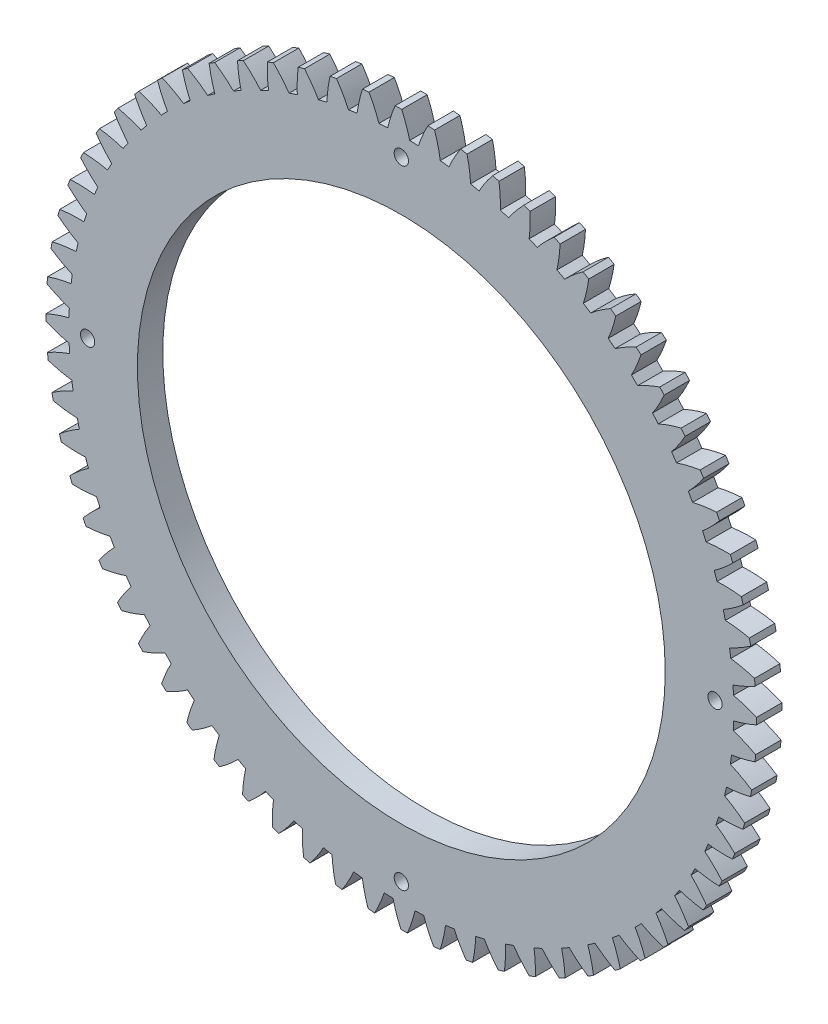
from build123d import *

# Parameters (mm, degrees)
BOSS_EXTRUDE1_DEPTH = 6.35
SKETCH3_R           = 66.04
CUT_EXTRUDE1_DEPTH  = 6.35
SKETCH4_R           = 1.7859375
CUT_EXTRUDE2_DEPTH  = 6.35
CIRPATTERN1_COUNT   = 4


with BuildPart() as part:
    # Sketch1 → Boss-Extrude1 (new body)
    with BuildSketch(Plane.XY):
        with BuildLine():
            ThreePointArc((-88.886888556, -1.526775321), (-86.041824866, -2.597533758), (-83.113641429, -3.41402184))
            ThreePointArc((-83.113641429, -3.41402184), (-83.061763444, -4.502931296), (-82.995619777, -5.591067383))
            ThreePointArc((-82.995619777, -5.591067383), (-85.818374995, -6.719324449), (-88.531009456, -8.091375947))
            ThreePointArc((-88.531009456, -8.091375947), (-88.45268089, -8.906921099), (-88.366839705, -9.721709751))
            ThreePointArc((-88.366839705, -9.721709751), (-85.435115431, -10.525391163), (-82.444087093, -11.068217569))
            ThreePointArc((-82.444087093, -11.068217569), (-82.291958521, -12.147695232), (-82.12569648, -13.225086554))
            ThreePointArc((-82.12569648, -13.225086554), (-84.832307893, -14.608981668), (-87.406773793, -16.225470568))
            ThreePointArc((-87.406773793, -16.225470568), (-87.253530349, -17.030309499), (-87.092876136, -17.833701982))
            ThreePointArc((-87.092876136, -17.833701982), (-84.099503716, -18.363449641), (-81.071148875, -18.627983167))
            ThreePointArc((-81.071148875, -18.627983167), (-80.820067624, -19.688819316), (-80.555105697, -20.746273951))
            ThreePointArc((-80.555105697, -20.746273951), (-83.122481452, -22.374000207), (-85.536814354, -24.221135195))
            ThreePointArc((-85.536814354, -24.221135195), (-85.309963452, -25.008401304), (-85.075866855, -25.793543355))
            ThreePointArc((-85.075866855, -25.793543355), (-82.046384686, -26.044837642), (-79.006540199, -26.028821382))
            ThreePointArc((-79.006540199, -26.028821382), (-78.658648405, -27.061965335), (-78.297247155, -28.090461453))
            ThreePointArc((-78.297247155, -28.090461453), (-80.703483306, -29.948131665), (-82.937084975, -32.010153637))
            ThreePointArc((-82.937084975, -32.010153637), (-82.638562027, -32.773130246), (-82.333020276, -33.533323311))
            ThreePointArc((-82.333020276, -33.533323311), (-79.293274832, -33.504020271), (-76.267875579, -33.207590869))
            ThreePointArc((-76.267875579, -33.207590869), (-75.826141333, -34.204228207), (-75.371384108, -35.194991042))
            ThreePointArc((-75.371384108, -35.194991042), (-77.595951496, -37.266756222), (-79.62976563, -39.526072734))
            ThreePointArc((-79.62976563, -39.526072734), (-79.262117528, -40.258250397), (-78.887737397, -40.987008776))
            ThreePointArc((-78.887737397, -40.987008776), (-75.863662715, -40.677358412), (-72.878520336, -40.1030449))
            ThreePointArc((-72.878520336, -40.1030449), (-72.346712358, -41.054672665), (-71.802478986, -41.999249377))
            ThreePointArc((-71.802478986, -41.999249377), (-73.826398388, -44.267433956), (-75.643073201, -46.704769315))
            ThreePointArc((-75.643073201, -46.704769315), (-75.209436589, -47.39990135), (-74.769412157, -48.091007534))
            ThreePointArc((-74.769412157, -48.091007534), (-71.786808576, -47.503651674), (-68.867391254, -46.656353892))
            ThreePointArc((-68.867391254, -46.656353892), (-68.250046743, -47.554853131), (-67.62098043, -48.445184925))
            ThreePointArc((-67.62098043, -48.445184925), (-69.426984479, -50.890437551), (-71.011020742, -53.484997272))
            ThreePointArc((-71.011020742, -53.484997272), (-70.515095255, -54.137153058), (-70.013180656, -54.784710772))
            ThreePointArc((-70.013180656, -54.784710772), (-67.097494698, -53.924660529), (-64.268709872, -52.811607324))
            ThreePointArc((-64.268709872, -52.811607324), (-63.571095793, -53.649312358), (-62.862563512, -54.477803236))
            ThreePointArc((-62.862563512, -54.477803236), (-64.435244017, -57.079261876), (-65.773127292, -59.80891009))
            ThreePointArc((-65.773127292, -59.80891009), (-65.219143992, -60.412525663), (-64.659621384, -61.011010174))
            ThreePointArc((-64.659621384, -61.011010174), (-61.835728653, -59.885603194), (-59.121710518, -58.516290742))
            ThreePointArc((-59.121710518, -58.516290742), (-58.349778668, -59.286054567), (-57.567825367, -60.045636138))
            ThreePointArc((-57.567825367, -60.045636138), (-58.893764773, -62.781106065), (-59.974080712, -65.622554376))
            ThreePointArc((-59.974080712, -65.622554376), (-59.366765987, -66.172479901), (-58.754409021, -66.716785149))
            ThreePointArc((-58.754409021, -66.716785149), (-56.046401973, -65.335623007), (-53.470305575, -63.7217338))
            ThreePointArc((-53.470305575, -63.7217338), (-52.630641805, -64.416989063), (-51.781938833, -65.101180845))
            ThreePointArc((-51.781938833, -65.101180845), (-52.849824694, -67.947323993), (-53.66335642, -70.876330165))
            ThreePointArc((-53.66335642, -70.876330165), (-53.007891667, -71.367873872), (-52.347924755, -71.853356037))
            ThreePointArc((-52.347924755, -71.853356037), (-49.778907154, -70.228222322), (-47.362710838, -68.383525493))
            ThreePointArc((-47.362710838, -68.383525493), (-46.462478863, -68.998340521), (-45.554267055, -69.60130523))
            ThreePointArc((-45.554267055, -69.60130523), (-46.354988544, -72.53383931), (-46.894795293, -75.525414096))
            ThreePointArc((-46.894795293, -75.525414096), (-46.196772706, -75.954382306), (-45.494826454, -76.376899426))
            ThreePointArc((-45.494826454, -76.376899426), (-43.08671625, -74.521659205), (-40.851034152, -72.461893057))
            ThreePointArc((-40.851034152, -72.461893057), (-39.897914433, -72.991022466), (-38.937942333, -73.50761582))
            ThreePointArc((-38.937942333, -73.50761582), (-39.464667976, -76.501521485), (-39.726144307, -79.530141824))
            ThreePointArc((-39.726144307, -79.530141824), (-38.991519168, -79.892874732), (-38.253582334, -80.248822039))
            ThreePointArc((-38.253582334, -80.248822039), (-36.026924675, -78.179303568), (-33.990830846, -75.9220413))
            ThreePointArc((-33.990830846, -75.9220413), (-32.992955066, -76.360970742), (-31.989412816, -76.78678535))
            ThreePointArc((-31.989412816, -76.78678535), (-32.237648776, -79.816519652), (-32.218563865, -82.856346422))
            ThreePointArc((-32.218563865, -82.856346422), (-31.453603737, -83.14974932), (-30.685972137, -83.436089997))
            ThreePointArc((-30.685972137, -83.436089997), (-28.659764082, -81.169949678), (-26.840629756, -78.734449455))
            ThreePointArc((-26.840629756, -78.734449455), (-25.806511439, -79.079434141), (-24.767960907, -79.410837102))
            ThreePointArc((-24.767960907, -79.410837102), (-24.735589324, -82.450551416), (-24.436105996, -85.475649888))
            ThreePointArc((-24.436105996, -85.475649888), (-23.647337249, -85.697219564), (-22.856560045, -85.911510654))
            ThreePointArc((-22.856560045, -85.911510654), (-21.048088486, -83.468082397), (-19.461433877, -80.875123049))
            ThreePointArc((-19.461433877, -80.875123049), (-18.399895755, -81.12321969), (-17.33519749, -81.357383591))
            ThreePointArc((-17.33519749, -81.357383591), (-17.022494544, -84.381144146), (-16.445167887, -87.365705246))
            ThreePointArc((-16.445167887, -87.365705246), (-15.639320018, -87.513551347), (-14.832143843, -87.653964594))
            ThreePointArc((-14.832143843, -87.653964594), (-13.256838021, -85.054094867), (-11.916199906, -82.325798608))
            ThreePointArc((-11.916199906, -82.325798608), (-10.836298648, -82.474890532), (-9.754536279, -82.609817568))
            ThreePointArc((-9.754536279, -82.609817568), (-9.164169844, -85.591826707), (-8.313925404, -88.510387212))
            ThreePointArc((-8.313925404, -88.510387212), (-7.497873622, -88.583248366), (-6.681185018, -88.648585814))
            ThreePointArc((-6.681185018, -88.648585814), (-5.352484888, -85.914455789), (-4.269301119, -83.074099482))
            ThreePointArc((-4.269301119, -83.074099482), (-3.180250062, -83.122914688), (-2.090652805, -83.15745371))
            ThreePointArc((-2.090652805, -83.15745371), (-1.227659677, -86.072269981), (-0.11175144, -88.899929762))
            ThreePointArc((-0.11175144, -88.899929762), (0.707541988, -88.897184344), (1.526775321, -88.886888556))
            ThreePointArc((1.526775321, -88.886888556), (2.597533758, -86.041824866), (3.41402184, -83.113641429))
            ThreePointArc((3.41402184, -83.113641429), (4.502931296, -83.061763444), (5.591067383, -82.995619777))
            ThreePointArc((5.591067383, -82.995619777), (6.719324449, -85.818374995), (8.091375947, -88.531009456))
            ThreePointArc((8.091375947, -88.531009456), (8.906921099, -88.45268089), (9.721709751, -88.366839705))
            ThreePointArc((9.721709751, -88.366839705), (10.525391163, -85.435115431), (11.068217569, -82.444087093))
            ThreePointArc((11.068217569, -82.444087093), (12.147695232, -82.291958521), (13.225086554, -82.12569648))
            ThreePointArc((13.225086554, -82.12569648), (14.608981668, -84.832307893), (16.225470568, -87.406773793))
            ThreePointArc((16.225470568, -87.406773793), (17.030309499, -87.253530349), (17.833701982, -87.092876136))
            ThreePointArc((17.833701982, -87.092876136), (18.363449641, -84.099503716), (18.627983167, -81.071148875))
            ThreePointArc((18.627983167, -81.071148875), (19.688819316, -80.820067624), (20.746273951, -80.555105697))
            ThreePointArc((20.746273951, -80.555105697), (22.374000207, -83.122481452), (24.221135195, -85.536814354))
            ThreePointArc((24.221135195, -85.536814354), (25.008401304, -85.309963452), (25.793543355, -85.075866855))
            ThreePointArc((25.793543355, -85.075866855), (26.044837642, -82.046384686), (26.028821382, -79.006540199))
            ThreePointArc((26.028821382, -79.006540199), (27.061965335, -78.658648405), (28.090461453, -78.297247155))
            ThreePointArc((28.090461453, -78.297247155), (29.948131665, -80.703483306), (32.010153637, -82.937084975))
            ThreePointArc((32.010153637, -82.937084975), (32.773130246, -82.638562027), (33.533323311, -82.333020276))
            ThreePointArc((33.533323311, -82.333020276), (33.504020271, -79.293274832), (33.207590869, -76.267875579))
            ThreePointArc((33.207590869, -76.267875579), (34.204228207, -75.826141333), (35.194991042, -75.371384108))
            ThreePointArc((35.194991042, -75.371384108), (37.266756222, -77.595951496), (39.526072734, -79.62976563))
            ThreePointArc((39.526072734, -79.62976563), (40.258250397, -79.262117528), (40.987008776, -78.887737397))
            ThreePointArc((40.987008776, -78.887737397), (40.677358412, -75.863662715), (40.1030449, -72.878520336))
            ThreePointArc((40.1030449, -72.878520336), (41.054672665, -72.346712358), (41.999249377, -71.802478986))
            ThreePointArc((41.999249377, -71.802478986), (44.267433956, -73.826398388), (46.704769315, -75.643073201))
            ThreePointArc((46.704769315, -75.643073201), (47.39990135, -75.209436589), (48.091007534, -74.769412157))
            ThreePointArc((48.091007534, -74.769412157), (47.503651674, -71.786808576), (46.656353892, -68.867391254))
            ThreePointArc((46.656353892, -68.867391254), (47.554853131, -68.250046743), (48.445184925, -67.62098043))
            ThreePointArc((48.445184925, -67.62098043), (50.890437551, -69.426984479), (53.484997272, -71.011020742))
            ThreePointArc((53.484997272, -71.011020742), (54.137153058, -70.515095255), (54.784710772, -70.013180656))
            ThreePointArc((54.784710772, -70.013180656), (53.924660529, -67.097494698), (52.811607324, -64.268709872))
            ThreePointArc((52.811607324, -64.268709872), (53.649312358, -63.571095793), (54.477803236, -62.862563512))
            ThreePointArc((54.477803236, -62.862563512), (57.079261876, -64.435244017), (59.80891009, -65.773127292))
            ThreePointArc((59.80891009, -65.773127292), (60.412525663, -65.219143992), (61.011010174, -64.659621384))
            ThreePointArc((61.011010174, -64.659621384), (59.885603194, -61.835728653), (58.516290742, -59.121710518))
            ThreePointArc((58.516290742, -59.121710518), (59.286054567, -58.349778668), (60.045636138, -57.567825367))
            ThreePointArc((60.045636138, -57.567825367), (62.781106065, -58.893764773), (65.622554376, -59.974080712))
            ThreePointArc((65.622554376, -59.974080712), (66.172479901, -59.366765987), (66.716785149, -58.754409021))
            ThreePointArc((66.716785149, -58.754409021), (65.335623007, -56.046401973), (63.7217338, -53.470305575))
            ThreePointArc((63.7217338, -53.470305575), (64.416989063, -52.630641805), (65.101180845, -51.781938833))
            ThreePointArc((65.101180845, -51.781938833), (67.947323993, -52.849824694), (70.876330165, -53.66335642))
            ThreePointArc((70.876330165, -53.66335642), (71.367873872, -53.007891667), (71.853356037, -52.347924755))
            ThreePointArc((71.853356037, -52.347924755), (70.228222322, -49.778907154), (68.383525493, -47.362710838))
            ThreePointArc((68.383525493, -47.362710838), (68.998340521, -46.462478863), (69.60130523, -45.554267055))
            ThreePointArc((69.60130523, -45.554267055), (72.53383931, -46.354988544), (75.525414096, -46.894795293))
            ThreePointArc((75.525414096, -46.894795293), (75.954382306, -46.196772706), (76.376899426, -45.494826454))
            ThreePointArc((76.376899426, -45.494826454), (74.521659205, -43.08671625), (72.461893057, -40.851034152))
            ThreePointArc((72.461893057, -40.851034152), (72.991022466, -39.897914433), (73.50761582, -38.937942333))
            ThreePointArc((73.50761582, -38.937942333), (76.501521485, -39.464667976), (79.530141824, -39.726144307))
            ThreePointArc((79.530141824, -39.726144307), (79.892874732, -38.991519168), (80.248822039, -38.253582334))
            ThreePointArc((80.248822039, -38.253582334), (78.179303568, -36.026924675), (75.9220413, -33.990830846))
            ThreePointArc((75.9220413, -33.990830846), (76.360970742, -32.992955066), (76.78678535, -31.989412816))
            ThreePointArc((76.78678535, -31.989412816), (79.816519652, -32.237648776), (82.856346422, -32.218563865))
            ThreePointArc((82.856346422, -32.218563865), (83.14974932, -31.453603737), (83.436089997, -30.685972137))
            ThreePointArc((83.436089997, -30.685972137), (81.169949678, -28.659764082), (78.734449455, -26.840629756))
            ThreePointArc((78.734449455, -26.840629756), (79.079434141, -25.806511439), (79.410837102, -24.767960907))
            ThreePointArc((79.410837102, -24.767960907), (82.450551416, -24.735589324), (85.475649888, -24.436105996))
            ThreePointArc((85.475649888, -24.436105996), (85.697219564, -23.647337249), (85.911510654, -22.856560045))
            ThreePointArc((85.911510654, -22.856560045), (83.468082397, -21.048088486), (80.875123049, -19.461433877))
            ThreePointArc((80.875123049, -19.461433877), (81.12321969, -18.399895755), (81.357383591, -17.33519749))
            ThreePointArc((81.357383591, -17.33519749), (84.381144146, -17.022494544), (87.365705246, -16.445167887))
            ThreePointArc((87.365705246, -16.445167887), (87.513551347, -15.639320018), (87.653964594, -14.832143843))
            ThreePointArc((87.653964594, -14.832143843), (85.054094867, -13.256838021), (82.325798608, -11.916199906))
            ThreePointArc((82.325798608, -11.916199906), (82.474890532, -10.836298648), (82.609817568, -9.754536279))
            ThreePointArc((82.609817568, -9.754536279), (85.591826707, -9.164169844), (88.510387212, -8.313925404))
            ThreePointArc((88.510387212, -8.313925404), (88.583248366, -7.497873622), (88.648585814, -6.681185018))
            ThreePointArc((88.648585814, -6.681185018), (85.914455789, -5.352484888), (83.074099482, -4.269301119))
            ThreePointArc((83.074099482, -4.269301119), (83.122914688, -3.180250062), (83.15745371, -2.090652805))
            ThreePointArc((83.15745371, -2.090652805), (86.072269981, -1.227659677), (88.899929762, -0.11175144))
            ThreePointArc((88.899929762, -0.11175144), (88.897184344, 0.707541988), (88.886888556, 1.526775321))
            ThreePointArc((88.886888556, 1.526775321), (86.041824866, 2.597533758), (83.113641429, 3.41402184))
            ThreePointArc((83.113641429, 3.41402184), (83.061763444, 4.502931296), (82.995619777, 5.591067383))
            ThreePointArc((82.995619777, 5.591067383), (85.818374995, 6.719324449), (88.531009456, 8.091375947))
            ThreePointArc((88.531009456, 8.091375947), (88.45268089, 8.906921099), (88.366839705, 9.721709751))
            ThreePointArc((88.366839705, 9.721709751), (85.435115431, 10.525391163), (82.444087093, 11.068217569))
            ThreePointArc((82.444087093, 11.068217569), (82.291958521, 12.147695232), (82.12569648, 13.225086554))
            ThreePointArc((82.12569648, 13.225086554), (84.832307893, 14.608981668), (87.406773793, 16.225470568))
            ThreePointArc((87.406773793, 16.225470568), (87.253530349, 17.030309499), (87.092876136, 17.833701982))
            ThreePointArc((87.092876136, 17.833701982), (84.099503716, 18.363449641), (81.071148875, 18.627983167))
            ThreePointArc((81.071148875, 18.627983167), (80.820067624, 19.688819316), (80.555105697, 20.746273951))
            ThreePointArc((80.555105697, 20.746273951), (83.122481452, 22.374000207), (85.536814354, 24.221135195))
            ThreePointArc((85.536814354, 24.221135195), (85.309963452, 25.008401304), (85.075866855, 25.793543355))
            ThreePointArc((85.075866855, 25.793543355), (82.046384686, 26.044837642), (79.006540199, 26.028821382))
            ThreePointArc((79.006540199, 26.028821382), (78.658648405, 27.061965335), (78.297247155, 28.090461453))
            ThreePointArc((78.297247155, 28.090461453), (80.703483306, 29.948131665), (82.937084975, 32.010153637))
            ThreePointArc((82.937084975, 32.010153637), (82.638562027, 32.773130246), (82.333020276, 33.533323311))
            ThreePointArc((82.333020276, 33.533323311), (79.293274832, 33.504020271), (76.267875579, 33.207590869))
            ThreePointArc((76.267875579, 33.207590869), (75.826141333, 34.204228207), (75.371384108, 35.194991042))
            ThreePointArc((75.371384108, 35.194991042), (77.595951496, 37.266756222), (79.62976563, 39.526072734))
            ThreePointArc((79.62976563, 39.526072734), (79.262117528, 40.258250397), (78.887737397, 40.987008776))
            ThreePointArc((78.887737397, 40.987008776), (75.863662715, 40.677358412), (72.878520336, 40.1030449))
            ThreePointArc((72.878520336, 40.1030449), (72.346712358, 41.054672665), (71.802478986, 41.999249377))
            ThreePointArc((71.802478986, 41.999249377), (73.826398388, 44.267433956), (75.643073201, 46.704769315))
            ThreePointArc((75.643073201, 46.704769315), (75.209436589, 47.39990135), (74.769412157, 48.091007534))
            ThreePointArc((74.769412157, 48.091007534), (71.786808576, 47.503651674), (68.867391254, 46.656353892))
            ThreePointArc((68.867391254, 46.656353892), (68.250046743, 47.554853131), (67.62098043, 48.445184925))
            ThreePointArc((67.62098043, 48.445184925), (69.426984479, 50.890437551), (71.011020742, 53.484997272))
            ThreePointArc((71.011020742, 53.484997272), (70.515095255, 54.137153058), (70.013180656, 54.784710772))
            ThreePointArc((70.013180656, 54.784710772), (67.097494698, 53.924660529), (64.268709872, 52.811607324))
            ThreePointArc((64.268709872, 52.811607324), (63.571095793, 53.649312358), (62.862563512, 54.477803236))
            ThreePointArc((62.862563512, 54.477803236), (64.435244017, 57.079261876), (65.773127292, 59.80891009))
            ThreePointArc((65.773127292, 59.80891009), (65.219143992, 60.412525663), (64.659621384, 61.011010174))
            ThreePointArc((64.659621384, 61.011010174), (61.835728653, 59.885603194), (59.121710518, 58.516290742))
            ThreePointArc((59.121710518, 58.516290742), (58.349778668, 59.286054567), (57.567825367, 60.045636138))
            ThreePointArc((57.567825367, 60.045636138), (58.893764773, 62.781106065), (59.974080712, 65.622554376))
            ThreePointArc((59.974080712, 65.622554376), (59.366765987, 66.172479901), (58.754409021, 66.716785149))
            ThreePointArc((58.754409021, 66.716785149), (56.046401973, 65.335623007), (53.470305575, 63.7217338))
            ThreePointArc((53.470305575, 63.7217338), (52.630641805, 64.416989063), (51.781938833, 65.101180845))
            ThreePointArc((51.781938833, 65.101180845), (52.849824694, 67.947323993), (53.66335642, 70.876330165))
            ThreePointArc((53.66335642, 70.876330165), (53.007891667, 71.367873872), (52.347924755, 71.853356037))
            ThreePointArc((52.347924755, 71.853356037), (49.778907154, 70.228222322), (47.362710838, 68.383525493))
            ThreePointArc((47.362710838, 68.383525493), (46.462478863, 68.998340521), (45.554267055, 69.60130523))
            ThreePointArc((45.554267055, 69.60130523), (46.354988544, 72.53383931), (46.894795293, 75.525414096))
            ThreePointArc((46.894795293, 75.525414096), (46.196772706, 75.954382306), (45.494826454, 76.376899426))
            ThreePointArc((45.494826454, 76.376899426), (43.08671625, 74.521659205), (40.851034152, 72.461893057))
            ThreePointArc((40.851034152, 72.461893057), (39.897914433, 72.991022466), (38.937942333, 73.50761582))
            ThreePointArc((38.937942333, 73.50761582), (39.464667976, 76.501521485), (39.726144307, 79.530141824))
            ThreePointArc((39.726144307, 79.530141824), (38.991519168, 79.892874732), (38.253582334, 80.248822039))
            ThreePointArc((38.253582334, 80.248822039), (36.026924675, 78.179303568), (33.990830846, 75.9220413))
            ThreePointArc((33.990830846, 75.9220413), (32.992955066, 76.360970742), (31.989412816, 76.78678535))
            ThreePointArc((31.989412816, 76.78678535), (32.237648776, 79.816519652), (32.218563865, 82.856346422))
            ThreePointArc((32.218563865, 82.856346422), (31.453603737, 83.14974932), (30.685972137, 83.436089997))
            ThreePointArc((30.685972137, 83.436089997), (28.659764082, 81.169949678), (26.840629756, 78.734449455))
            ThreePointArc((26.840629756, 78.734449455), (25.806511439, 79.079434141), (24.767960907, 79.410837102))
            ThreePointArc((24.767960907, 79.410837102), (24.735589324, 82.450551416), (24.436105996, 85.475649888))
            ThreePointArc((24.436105996, 85.475649888), (23.647337249, 85.697219564), (22.856560045, 85.911510654))
            ThreePointArc((22.856560045, 85.911510654), (21.048088486, 83.468082397), (19.461433877, 80.875123049))
            ThreePointArc((19.461433877, 80.875123049), (18.399895755, 81.12321969), (17.33519749, 81.357383591))
            ThreePointArc((17.33519749, 81.357383591), (17.022494544, 84.381144146), (16.445167887, 87.365705246))
            ThreePointArc((16.445167887, 87.365705246), (15.639320018, 87.513551347), (14.832143843, 87.653964594))
            ThreePointArc((14.832143843, 87.653964594), (13.256838021, 85.054094867), (11.916199906, 82.325798608))
            ThreePointArc((11.916199906, 82.325798608), (10.836298648, 82.474890532), (9.754536279, 82.609817568))
            ThreePointArc((9.754536279, 82.609817568), (9.164169844, 85.591826707), (8.313925404, 88.510387212))
            ThreePointArc((8.313925404, 88.510387212), (7.497873622, 88.583248366), (6.681185018, 88.648585814))
            ThreePointArc((6.681185018, 88.648585814), (5.352484888, 85.914455789), (4.269301119, 83.074099482))
            ThreePointArc((4.269301119, 83.074099482), (3.180250062, 83.122914688), (2.090652805, 83.15745371))
            ThreePointArc((2.090652805, 83.15745371), (1.227659677, 86.072269981), (0.11175144, 88.899929762))
            ThreePointArc((0.11175144, 88.899929762), (-0.707541988, 88.897184344), (-1.526775321, 88.886888556))
            ThreePointArc((-1.526775321, 88.886888556), (-2.597533758, 86.041824866), (-3.41402184, 83.113641429))
            ThreePointArc((-3.41402184, 83.113641429), (-4.502931296, 83.061763444), (-5.591067383, 82.995619777))
            ThreePointArc((-5.591067383, 82.995619777), (-6.719324449, 85.818374995), (-8.091375947, 88.531009456))
            ThreePointArc((-8.091375947, 88.531009456), (-8.906921099, 88.45268089), (-9.721709751, 88.366839705))
            ThreePointArc((-9.721709751, 88.366839705), (-10.525391163, 85.435115431), (-11.068217569, 82.444087093))
            ThreePointArc((-11.068217569, 82.444087093), (-12.147695232, 82.291958521), (-13.225086554, 82.12569648))
            ThreePointArc((-13.225086554, 82.12569648), (-14.608981668, 84.832307893), (-16.225470568, 87.406773793))
            ThreePointArc((-16.225470568, 87.406773793), (-17.030309499, 87.253530349), (-17.833701982, 87.092876136))
            ThreePointArc((-17.833701982, 87.092876136), (-18.363449641, 84.099503716), (-18.627983167, 81.071148875))
            ThreePointArc((-18.627983167, 81.071148875), (-19.688819316, 80.820067624), (-20.746273951, 80.555105697))
            ThreePointArc((-20.746273951, 80.555105697), (-22.374000207, 83.122481452), (-24.221135195, 85.536814354))
            ThreePointArc((-24.221135195, 85.536814354), (-25.008401304, 85.309963452), (-25.793543355, 85.075866855))
            ThreePointArc((-25.793543355, 85.075866855), (-26.044837642, 82.046384686), (-26.028821382, 79.006540199))
            ThreePointArc((-26.028821382, 79.006540199), (-27.061965335, 78.658648405), (-28.090461453, 78.297247155))
            ThreePointArc((-28.090461453, 78.297247155), (-29.948131665, 80.703483306), (-32.010153637, 82.937084975))
            ThreePointArc((-32.010153637, 82.937084975), (-32.773130246, 82.638562027), (-33.533323311, 82.333020276))
            ThreePointArc((-33.533323311, 82.333020276), (-33.504020271, 79.293274832), (-33.207590869, 76.267875579))
            ThreePointArc((-33.207590869, 76.267875579), (-34.204228207, 75.826141333), (-35.194991042, 75.371384108))
            ThreePointArc((-35.194991042, 75.371384108), (-37.266756222, 77.595951496), (-39.526072734, 79.62976563))
            ThreePointArc((-39.526072734, 79.62976563), (-40.258250397, 79.262117528), (-40.987008776, 78.887737397))
            ThreePointArc((-40.987008776, 78.887737397), (-40.677358412, 75.863662715), (-40.1030449, 72.878520336))
            ThreePointArc((-40.1030449, 72.878520336), (-41.054672665, 72.346712358), (-41.999249377, 71.802478986))
            ThreePointArc((-41.999249377, 71.802478986), (-44.267433956, 73.826398388), (-46.704769315, 75.643073201))
            ThreePointArc((-46.704769315, 75.643073201), (-47.39990135, 75.209436589), (-48.091007534, 74.769412157))
            ThreePointArc((-48.091007534, 74.769412157), (-47.503651674, 71.786808576), (-46.656353892, 68.867391254))
            ThreePointArc((-46.656353892, 68.867391254), (-47.554853131, 68.250046743), (-48.445184925, 67.62098043))
            ThreePointArc((-48.445184925, 67.62098043), (-50.890437551, 69.426984479), (-53.484997272, 71.011020742))
            ThreePointArc((-53.484997272, 71.011020742), (-54.137153058, 70.515095255), (-54.784710772, 70.013180656))
            ThreePointArc((-54.784710772, 70.013180656), (-53.924660529, 67.097494698), (-52.811607324, 64.268709872))
            ThreePointArc((-52.811607324, 64.268709872), (-53.649312358, 63.571095793), (-54.477803236, 62.862563512))
            ThreePointArc((-54.477803236, 62.862563512), (-57.079261876, 64.435244017), (-59.80891009, 65.773127292))
            ThreePointArc((-59.80891009, 65.773127292), (-60.412525663, 65.219143992), (-61.011010174, 64.659621384))
            ThreePointArc((-61.011010174, 64.659621384), (-59.885603194, 61.835728653), (-58.516290742, 59.121710518))
            ThreePointArc((-58.516290742, 59.121710518), (-59.286054567, 58.349778668), (-60.045636138, 57.567825367))
            ThreePointArc((-60.045636138, 57.567825367), (-62.781106065, 58.893764773), (-65.622554376, 59.974080712))
            ThreePointArc((-65.622554376, 59.974080712), (-66.172479901, 59.366765987), (-66.716785149, 58.754409021))
            ThreePointArc((-66.716785149, 58.754409021), (-65.335623007, 56.046401973), (-63.7217338, 53.470305575))
            ThreePointArc((-63.7217338, 53.470305575), (-64.416989063, 52.630641805), (-65.101180845, 51.781938833))
            ThreePointArc((-65.101180845, 51.781938833), (-67.947323993, 52.849824694), (-70.876330165, 53.66335642))
            ThreePointArc((-70.876330165, 53.66335642), (-71.367873872, 53.007891667), (-71.853356037, 52.347924755))
            ThreePointArc((-71.853356037, 52.347924755), (-70.228222322, 49.778907154), (-68.383525493, 47.362710838))
            ThreePointArc((-68.383525493, 47.362710838), (-68.998340521, 46.462478863), (-69.60130523, 45.554267055))
            ThreePointArc((-69.60130523, 45.554267055), (-72.53383931, 46.354988544), (-75.525414096, 46.894795293))
            ThreePointArc((-75.525414096, 46.894795293), (-75.954382306, 46.196772706), (-76.376899426, 45.494826454))
            ThreePointArc((-76.376899426, 45.494826454), (-74.521659205, 43.08671625), (-72.461893057, 40.851034152))
            ThreePointArc((-72.461893057, 40.851034152), (-72.991022466, 39.897914433), (-73.50761582, 38.937942333))
            ThreePointArc((-73.50761582, 38.937942333), (-76.501521485, 39.464667976), (-79.530141824, 39.726144307))
            ThreePointArc((-79.530141824, 39.726144307), (-79.892874732, 38.991519168), (-80.248822039, 38.253582334))
            ThreePointArc((-80.248822039, 38.253582334), (-78.179303568, 36.026924675), (-75.9220413, 33.990830846))
            ThreePointArc((-75.9220413, 33.990830846), (-76.360970742, 32.992955066), (-76.78678535, 31.989412816))
            ThreePointArc((-76.78678535, 31.989412816), (-79.816519652, 32.237648776), (-82.856346422, 32.218563865))
            ThreePointArc((-82.856346422, 32.218563865), (-83.14974932, 31.453603737), (-83.436089997, 30.685972137))
            ThreePointArc((-83.436089997, 30.685972137), (-81.169949678, 28.659764082), (-78.734449455, 26.840629756))
            ThreePointArc((-78.734449455, 26.840629756), (-79.079434141, 25.806511439), (-79.410837102, 24.767960907))
            ThreePointArc((-79.410837102, 24.767960907), (-82.450551416, 24.735589324), (-85.475649888, 24.436105996))
            ThreePointArc((-85.475649888, 24.436105996), (-85.697219564, 23.647337249), (-85.911510654, 22.856560045))
            ThreePointArc((-85.911510654, 22.856560045), (-83.468082397, 21.048088486), (-80.875123049, 19.461433877))
            ThreePointArc((-80.875123049, 19.461433877), (-81.12321969, 18.399895755), (-81.357383591, 17.33519749))
            ThreePointArc((-81.357383591, 17.33519749), (-84.381144146, 17.022494544), (-87.365705246, 16.445167887))
            ThreePointArc((-87.365705246, 16.445167887), (-87.513551347, 15.639320018), (-87.653964594, 14.832143843))
            ThreePointArc((-87.653964594, 14.832143843), (-85.054094867, 13.256838021), (-82.325798608, 11.916199906))
            ThreePointArc((-82.325798608, 11.916199906), (-82.474890532, 10.836298648), (-82.609817568, 9.754536279))
            ThreePointArc((-82.609817568, 9.754536279), (-85.591826707, 9.164169844), (-88.510387212, 8.313925404))
            ThreePointArc((-88.510387212, 8.313925404), (-88.583248366, 7.497873622), (-88.648585814, 6.681185018))
            ThreePointArc((-88.648585814, 6.681185018), (-85.914455789, 5.352484888), (-83.074099482, 4.269301119))
            ThreePointArc((-83.074099482, 4.269301119), (-83.122914688, 3.180250062), (-83.15745371, 2.090652805))
            ThreePointArc((-83.15745371, 2.090652805), (-86.072269981, 1.227659677), (-88.899929762, 0.11175144))
            ThreePointArc((-88.899929762, 0.11175144), (-88.897184344, -0.707541988), (-88.886888556, -1.526775321))
        make_face()
    extrude(amount=BOSS_EXTRUDE1_DEPTH)

    # Sketch3 → Cut-Extrude1 (cut)
    with BuildSketch(Plane.XY.offset(6.35)):
        Circle(SKETCH3_R)
    extrude(amount=-CUT_EXTRUDE1_DEPTH, mode=Mode.SUBTRACT)

    # Sketch4 → Cut-Extrude2 (cut)
    with BuildSketch(Plane(origin=(0, 0, 0), x_dir=(-1, 0, 0), z_dir=(0, 0, -1))):
        with Locations((0, 78.5)):
            Circle(SKETCH4_R)
    cut_extrude2 = extrude(amount=-CUT_EXTRUDE2_DEPTH, mode=Mode.SUBTRACT)

    # CirPattern1: Cut-Extrude2 ×4 about axis
    cirpattern1_axis = Axis((0, 0, 0), (0, 0, 1))
    for i in range(1, CIRPATTERN1_COUNT):
        add(cut_extrude2.rotate(cirpattern1_axis, i * 360 / CIRPATTERN1_COUNT), mode=Mode.SUBTRACT)


solid = part.part
